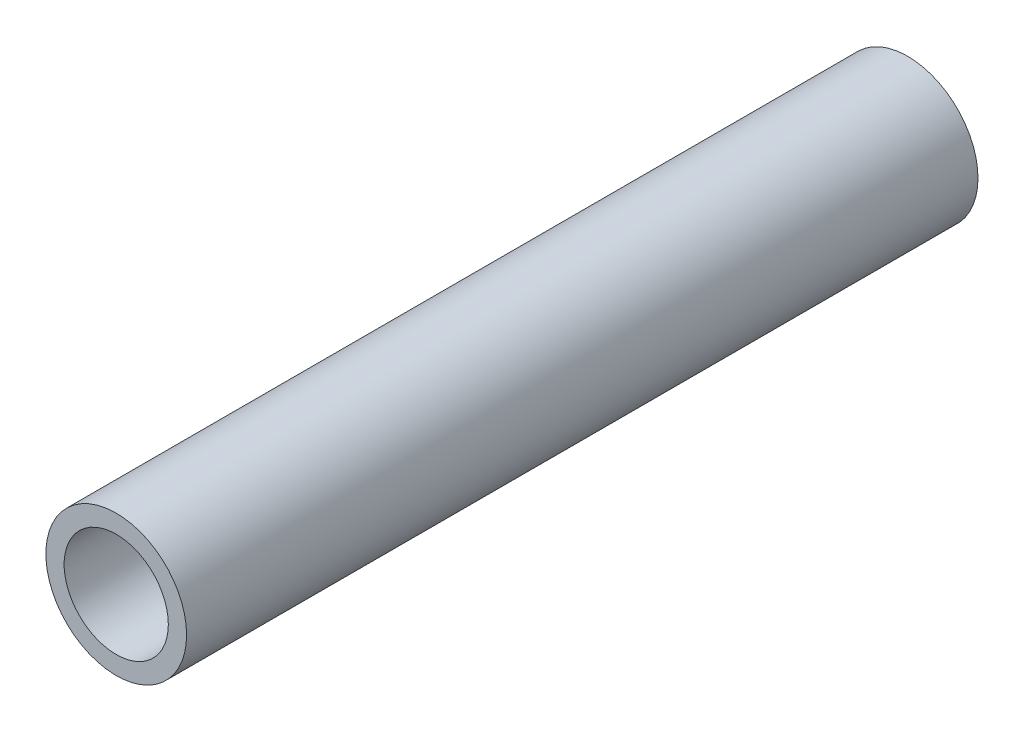
from build123d import *

# Parameters (mm, degrees)
SKETCH1_R           = 10.668
SKETCH1_R_2         = 7.8994
EXTRUDE_THIN1_DEPTH = 60


with BuildPart() as part:
    # Sketch1 → Extrude-Thin1 (new, symmetric)
    with BuildSketch(Plane.XY):
        Circle(SKETCH1_R)
        Circle(SKETCH1_R_2, mode=Mode.SUBTRACT)
    extrude(amount=EXTRUDE_THIN1_DEPTH, both=True)


solid = part.part
